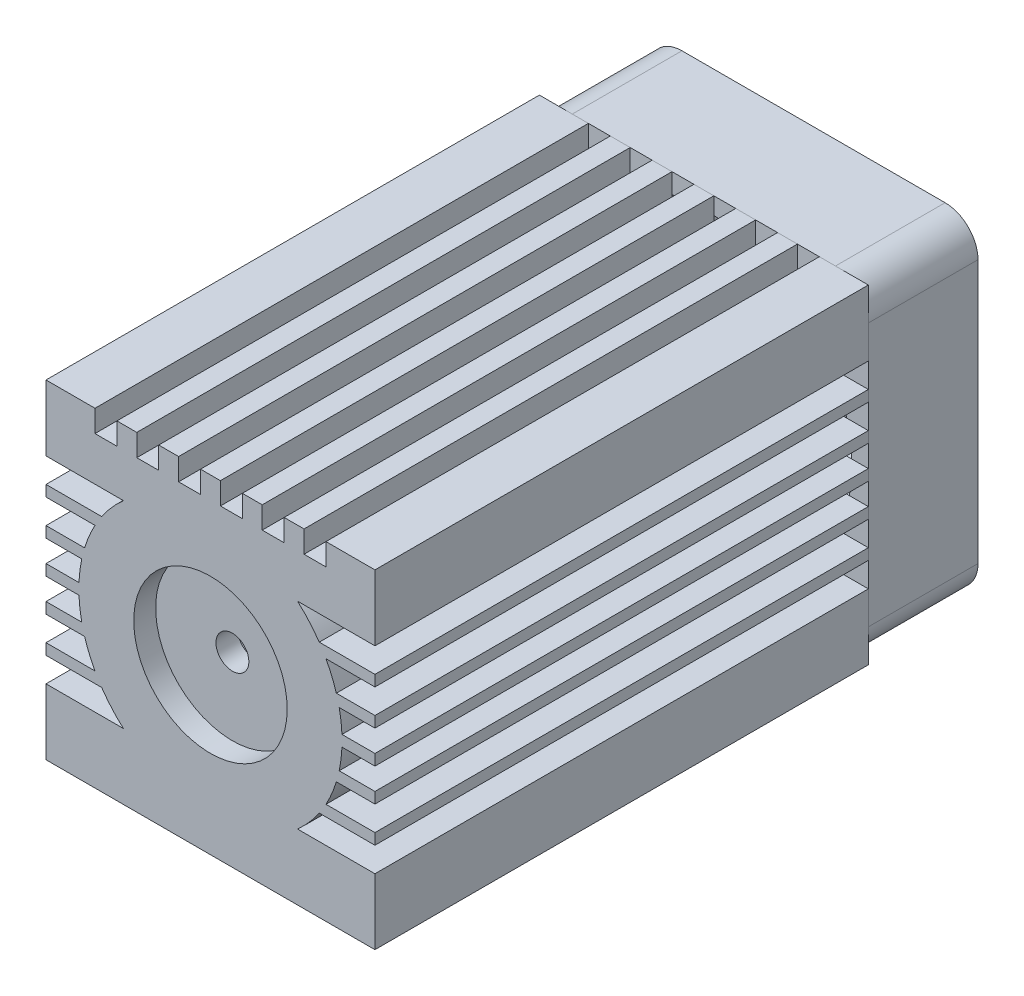
from build123d import *

# Parameters (mm, degrees)
BOSS_EXTRUDE1_DEPTH = 45
SKETCH2_R           = 7
CUT_EXTRUDE1_DEPTH  = 2
SKETCH3_R           = 1.5
CUT_EXTRUDE2_DEPTH  = 2
SKETCH4_R           = 1.25
CUT_EXTRUDE5_DEPTH  = 4
SKETCH5_R           = 13.5
BOSS_EXTRUDE2_DEPTH = 10
SKETCH6_R           = 8.5
BOSS_EXTRUDE3_DEPTH = 10
BOSS_EXTRUDE4_DEPTH = 12
CIRPATTERN1_COUNT   = 5


with BuildPart() as part:
    # Sketch1 → Boss-Extrude1 (new body)
    with BuildSketch(Plane.XY):
        with BuildLine():
            Line((-15, -9), (-7.937253933, -9))
            ThreePointArc((-7.937253933, -9), (-9, -7.937253933), (-9.921567416, -6.75))
            Line((-9.921567416, -6.75), (-15, -6.75))
            Line((-15, -6.75), (-15, -5.75))
            Line((-15, -5.75), (-10.532687216, -5.75))
            ThreePointArc((-10.532687216, -5.75), (-11.06281417, -4.649101273), (-11.478240283, -3.5))
            Line((-11.478240283, -3.5), (-15, -3.5))
            Line((-15, -3.5), (-15, -2.5))
            Line((-15, -2.5), (-11.736694594, -2.5))
            ThreePointArc((-11.736694594, -2.5), (-11.905209464, -1.505319769), (-11.989578808, -0.5))
            Line((-11.989578808, -0.5), (-15, -0.5))
            Line((-15, -0.5), (-15, 0.5))
            Line((-15, 0.5), (-11.989578808, 0.5))
            ThreePointArc((-11.989578808, 0.5), (-11.905209464, 1.505319769), (-11.736694594, 2.5))
            Line((-11.736694594, 2.5), (-15, 2.5))
            Line((-15, 2.5), (-15, 3.5))
            Line((-15, 3.5), (-11.478240283, 3.5))
            ThreePointArc((-11.478240283, 3.5), (-11.06281417, 4.649101273), (-10.532687216, 5.75))
            Line((-10.532687216, 5.75), (-15, 5.75))
            Line((-15, 5.75), (-15, 6.75))
            Line((-15, 6.75), (-9.921567416, 6.75))
            ThreePointArc((-9.921567416, 6.75), (-9, 7.937253933), (-7.937253933, 9))
            Line((-7.937253933, 9), (-15, 9))
            Line((-15, 9), (-15, 15))
            Line((-15, 15), (-10.532687216, 15))
            Line((-10.532687216, 15), (-10.532687216, 13))
            Line((-10.532687216, 13), (-8.532687216, 13))
            Line((-8.532687216, 13), (-8.532687216, 15))
            Line((-8.532687216, 15), (-6.71961233, 15))
            Line((-6.71961233, 15), (-6.71961233, 13))
            Line((-6.71961233, 13), (-4.71961233, 13))
            Line((-4.71961233, 13), (-4.71961233, 15))
            Line((-4.71961233, 15), (-2.906537443, 15))
            Line((-2.906537443, 15), (-2.906537443, 13))
            Line((-2.906537443, 13), (-0.906537443, 13))
            Line((-0.906537443, 13), (-0.906537443, 15))
            Line((-0.906537443, 15), (0.906537443, 15))
            Line((0.906537443, 15), (0.906537443, 13))
            Line((0.906537443, 13), (2.906537443, 13))
            Line((2.906537443, 13), (2.906537443, 15))
            Line((2.906537443, 15), (4.71961233, 15))
            Line((4.71961233, 15), (4.71961233, 13))
            Line((4.71961233, 13), (6.71961233, 13))
            Line((6.71961233, 13), (6.71961233, 15))
            Line((6.71961233, 15), (8.532687216, 15))
            Line((8.532687216, 15), (8.532687216, 13))
            Line((8.532687216, 13), (10.532687216, 13))
            Line((10.532687216, 13), (10.532687216, 15))
            Line((10.532687216, 15), (15, 15))
            Line((15, 15), (15, 9))
            Line((15, 9), (7.937253933, 9))
            ThreePointArc((7.937253933, 9), (9, 7.937253933), (9.921567416, 6.75))
            Line((9.921567416, 6.75), (15, 6.75))
            Line((15, 6.75), (15, 5.75))
            Line((15, 5.75), (10.532687216, 5.75))
            ThreePointArc((10.532687216, 5.75), (11.06281417, 4.649101273), (11.478240283, 3.5))
            Line((11.478240283, 3.5), (15, 3.5))
            Line((15, 3.5), (15, 2.5))
            Line((15, 2.5), (11.736694594, 2.5))
            ThreePointArc((11.736694594, 2.5), (11.905209464, 1.505319769), (11.989578808, 0.5))
            Line((11.989578808, 0.5), (15, 0.5))
            Line((15, 0.5), (15, -0.5))
            Line((15, -0.5), (11.989578808, -0.5))
            ThreePointArc((11.989578808, -0.5), (11.905209464, -1.505319769), (11.736694594, -2.5))
            Line((11.736694594, -2.5), (15, -2.5))
            Line((15, -2.5), (15, -3.5))
            Line((15, -3.5), (11.478240283, -3.5))
            ThreePointArc((11.478240283, -3.5), (11.06281417, -4.649101273), (10.532687216, -5.75))
            Line((10.532687216, -5.75), (15, -5.75))
            Line((15, -5.75), (15, -6.75))
            Line((15, -6.75), (9.921567416, -6.75))
            ThreePointArc((9.921567416, -6.75), (9, -7.937253933), (7.937253933, -9))
            Line((7.937253933, -9), (15, -9))
            Line((15, -9), (15, -15))
            Line((15, -15), (-15, -15))
            Line((-15, -15), (-15, -9))
        make_face()
    extrude(amount=-BOSS_EXTRUDE1_DEPTH)

    # Sketch2 → Cut-Extrude1 (cut)
    with BuildSketch(Plane.XY):
        Circle(SKETCH2_R)
    extrude(amount=-CUT_EXTRUDE1_DEPTH, mode=Mode.SUBTRACT)

    # Sketch3 → Cut-Extrude2 (cut)
    with BuildSketch(Plane.XY.offset(-2)):
        Circle(SKETCH3_R)
    extrude(amount=-CUT_EXTRUDE2_DEPTH, mode=Mode.SUBTRACT)

    # Sketch4 → Cut-Extrude5 (cut)
    with BuildSketch(Plane.XZ.offset(15)):
        with Locations(Location((-8, -2.25, 0), (0, 0, 270))):
            Circle(SKETCH4_R)
        with Locations(Location((0, -2.25, 0), (0, 0, 270))):
            Circle(SKETCH4_R)
        with Locations(Location((8, -2.25, 0), (0, 0, 270))):
            Circle(SKETCH4_R)
        with Locations(Location((8, -42.75, 0), (0, 0, 90))):
            Circle(SKETCH4_R)
        with Locations(Location((0, -42.75, 0), (0, 0, 90))):
            Circle(SKETCH4_R)
        with Locations(Location((-8, -42.75, 0), (0, 0, 90))):
            Circle(SKETCH4_R)
    extrude(amount=-CUT_EXTRUDE5_DEPTH, mode=Mode.SUBTRACT)


with BuildPart() as body_2:
    # Sketch5 → Boss-Extrude2 (new body)
    with BuildSketch(Plane(origin=(0, 0, -45), x_dir=(-1, 0, 0), z_dir=(0, 0, -1))):
        with BuildLine():
            Line((-12, 15), (12, 15))
            ThreePointArc((12, 15), (14.121320344, 14.121320344), (15, 12))
            Line((15, 12), (15, -12))
            ThreePointArc((15, -12), (14.121320344, -14.121320344), (12, -15))
            Line((12, -15), (-12, -15))
            ThreePointArc((-12, -15), (-14.121320344, -14.121320344), (-15, -12))
            Line((-15, -12), (-15, 12))
            ThreePointArc((-15, 12), (-14.121320344, 14.121320344), (-12, 15))
        make_face()
        Circle(SKETCH5_R, mode=Mode.SUBTRACT)
    extrude(amount=BOSS_EXTRUDE2_DEPTH)


with BuildPart() as body_3:
    # Sketch6 → Boss-Extrude3 (new body)
    with BuildSketch(Plane(origin=(0, 0, -45), x_dir=(-1, 0, 0), z_dir=(0, 0, -1))):
        Circle(SKETCH6_R)
    extrude(amount=BOSS_EXTRUDE3_DEPTH)

    # Sketch7 → Boss-Extrude4 (add)
    with BuildSketch(Plane(origin=(0, 0, 0), x_dir=(-1, 0, 0), z_dir=(0, -1, 0))):
        Polygon((-4, 53.292893219), (-3.292893219, 54), (4, 46.707106781), (3.292893219, 46), align=None)
    boss_extrude4 = extrude(amount=BOSS_EXTRUDE4_DEPTH)

    # CirPattern1: Boss-Extrude4 ×5 about axis
    cirpattern1_axis = Axis((0, 0, 0), (0, 0, 1))
    for i in range(1, CIRPATTERN1_COUNT):
        add(boss_extrude4.rotate(cirpattern1_axis, i * 360 / CIRPATTERN1_COUNT))


solid = Compound([part.part, body_2.part, body_3.part])
